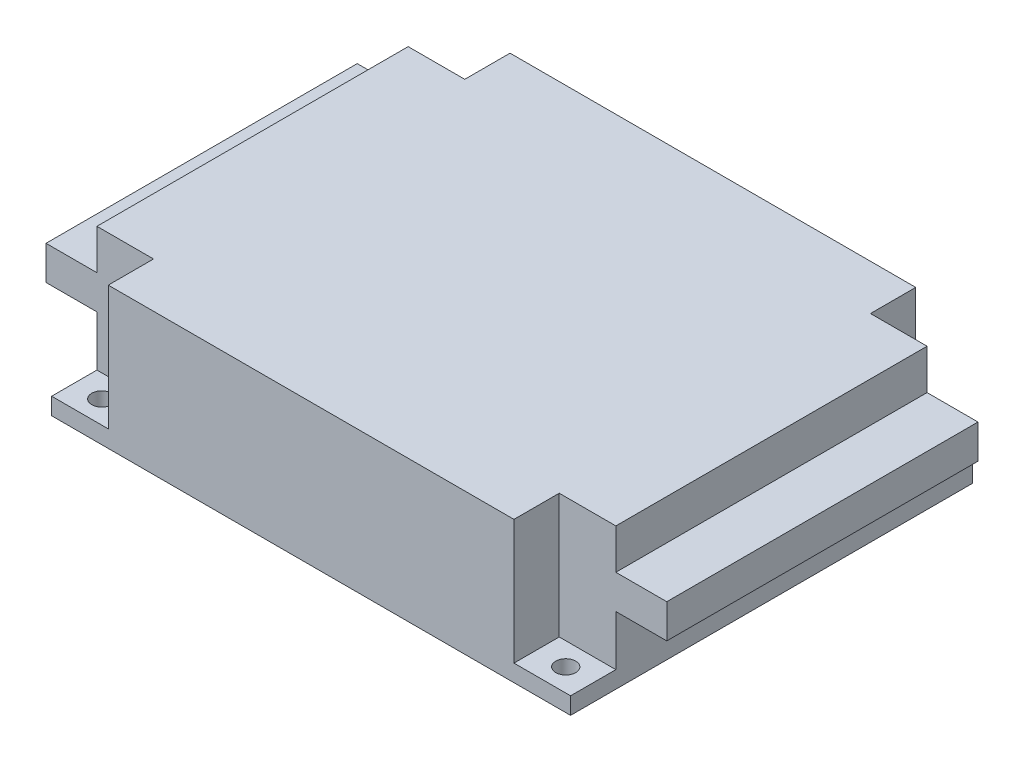
from build123d import *

# Parameters (mm, degrees)
SKETCH_1_W             = 91.7
SKETCH_1_H             = 71
EXTRUDE_1_DEPTH        = 25
SKETCH_2_W             = 10.00292335
SKETCH_2_H             = 22
CUT_EXTRUDE_1_DEPTH    = 8.000270383
SKETCH_3_W             = 54.999459234
SKETCH_3_H             = 13.1
EXTRUDE_2_DEPTH        = 9
SKETCH_4_W             = 8.000270383
SKETCH_4_H             = 22
CUT_EXTRUDE_2_DEPTH    = 10.00292335
SKETCH_5_W             = 8.000270383
SKETCH_5_H             = 22
CUT_EXTRUDE_3_DEPTH    = 10.00292335
SKETCH_6_W             = 54.999459234
SKETCH_6_H             = 13.1
EXTRUDE_3_DEPTH        = 9
SKETCH_7_W             = 8.000270383
SKETCH_7_H             = 22
CUT_EXTRUDE_4_DEPTH    = 10.00292335
SKETCH_8_W             = 9
SKETCH_8_H             = 7.1
CUT_EXTRUDE_5_DEPTH    = 122.38556723
SKETCH_9_W             = 9
SKETCH_9_H             = 7.1
CUT_EXTRUDE_6_DEPTH    = 122.38556723
HOLE_WIZARD_M3_1_D     = 3.531196766
HOLE_WIZARD_M3_1_DEPTH = 25


with BuildPart() as part:
    # 草图1 → 凸台-拉伸1 (new body)
    with BuildSketch(Plane(origin=(0, 25, 0), x_dir=(1, 0, 0), z_dir=(0, 1, 0))):
        with Locations((45.85, 24.5)):
            Rectangle(SKETCH_1_W, SKETCH_1_H)
    extrude(amount=-EXTRUDE_1_DEPTH)

    # 草图2 → 切除-拉伸1 (cut)
    with BuildSketch(Plane(origin=(0, 0, -60), x_dir=(-1, 0, 0), z_dir=(0, 0, -1))):
        with Locations((-5.001461675, 14)):
            Rectangle(SKETCH_2_W, SKETCH_2_H)
    extrude(amount=-CUT_EXTRUDE_1_DEPTH, mode=Mode.SUBTRACT)

    # 草图3 → 凸台-拉伸2 (add)
    with BuildSketch(Plane.ZY):
        with Locations((-24.5, 18.45)):
            Rectangle(SKETCH_3_W, SKETCH_3_H)
    extrude(amount=EXTRUDE_2_DEPTH)

    # 草图4 → 切除-拉伸2 (cut)
    with BuildSketch(Plane.ZY):
        with Locations((6.999864808, 14)):
            Rectangle(SKETCH_4_W, SKETCH_4_H)
    extrude(amount=-CUT_EXTRUDE_2_DEPTH, mode=Mode.SUBTRACT)

    # 草图5 → 切除-拉伸3 (cut)
    with BuildSketch(Plane(origin=(91.7, 0, 0), x_dir=(0, 0, -1), z_dir=(1, 0, 0))):
        with Locations((55.999864809, 14)):
            Rectangle(SKETCH_5_W, SKETCH_5_H)
    extrude(amount=-CUT_EXTRUDE_3_DEPTH, mode=Mode.SUBTRACT)

    # 草图6 → 凸台-拉伸3 (add)
    with BuildSketch(Plane(origin=(91.7, 0, 0), x_dir=(0, 0, -1), z_dir=(1, 0, 0))):
        with Locations((24.5, 18.45)):
            Rectangle(SKETCH_6_W, SKETCH_6_H)
    extrude(amount=EXTRUDE_3_DEPTH)

    # 草图7 → 切除-拉伸4 (cut)
    with BuildSketch(Plane(origin=(91.7, 0, 0), x_dir=(0, 0, -1), z_dir=(1, 0, 0))):
        with Locations((-6.999864808, 14)):
            Rectangle(SKETCH_7_W, SKETCH_7_H)
    extrude(amount=-CUT_EXTRUDE_4_DEPTH, mode=Mode.SUBTRACT)

    # 草图8 → 切除-拉伸5 (cut, through all)
    with BuildSketch(Plane(origin=(0, 0, -51.999729617), x_dir=(-1, 0, 0), z_dir=(0, 0, -1))):
        with Locations((4.5, 21.45)):
            Rectangle(SKETCH_8_W, SKETCH_8_H)
    extrude(amount=-CUT_EXTRUDE_5_DEPTH, mode=Mode.SUBTRACT)

    # 草图9 → 切除-拉伸6 (cut, through all)
    with BuildSketch(Plane.XY.offset(2.999729617)):
        with Locations((96.2, 21.45)):
            Rectangle(SKETCH_9_W, SKETCH_9_H)
    extrude(amount=-CUT_EXTRUDE_6_DEPTH, mode=Mode.SUBTRACT)

    # M3 间隙孔1
    with Locations(Plane(origin=(0, 0, 0), x_dir=(-1, 0, 0), z_dir=(0, -1, 0))):
        with Locations((-86.846324066, 55.999601401), (-86.846324066, -6.999601401), (-4.853675934, -6.999601401), (-4.853675934, 55.999601401)):
            Hole(HOLE_WIZARD_M3_1_D / 2, depth=HOLE_WIZARD_M3_1_DEPTH)


solid = part.part
